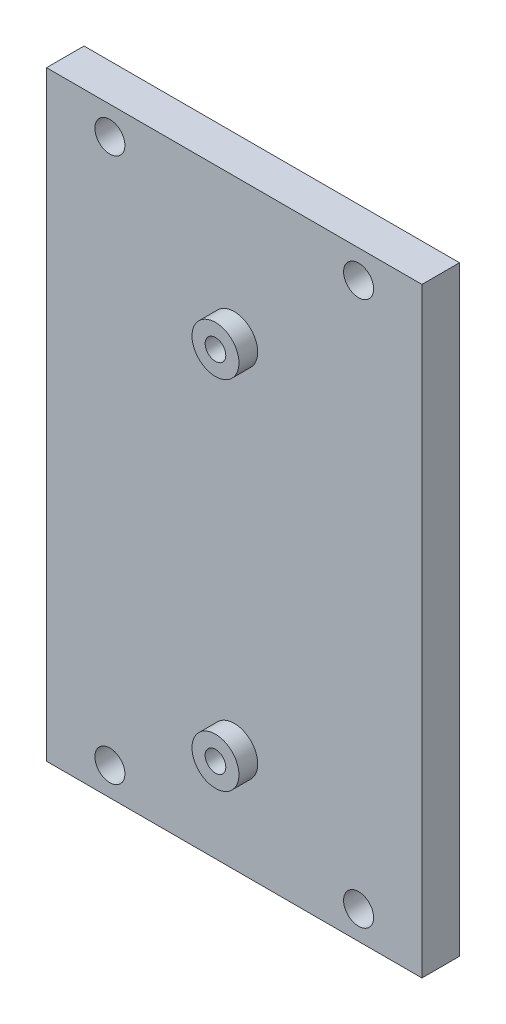
from build123d import *

# Parameters (mm, degrees)
SKETCH_1_W      = 40
SKETCH_1_H      = 64
SKETCH_1_R      = 1.6
SKETCH_1_R_2    = 1.1
EXTRUDE_1_DEPTH = 4
SKETCH_2_R      = 2.5
SKETCH_2_R_2    = 1.1
EXTRUDE_2_DEPTH = 2


with BuildPart() as part:
    # Эскиз1 → Бобышка-Вытянуть1 (new body)
    with BuildSketch(Plane.XY):
        Rectangle(SKETCH_1_W, SKETCH_1_H)
        with Locations((-13.25, 29)):
            Circle(SKETCH_1_R, mode=Mode.SUBTRACT)
        with Locations((13.25, 29)):
            Circle(SKETCH_1_R, mode=Mode.SUBTRACT)
        with Locations((-13.25, -29)):
            Circle(SKETCH_1_R, mode=Mode.SUBTRACT)
        with Locations((13.25, -29)):
            Circle(SKETCH_1_R, mode=Mode.SUBTRACT)
        with Locations((0, -21)):
            Circle(SKETCH_1_R_2, mode=Mode.SUBTRACT)
        with Locations((0, 17)):
            Circle(SKETCH_1_R_2, mode=Mode.SUBTRACT)
    extrude(amount=EXTRUDE_1_DEPTH)

    # Эскиз2 → Бобышка-Вытянуть2 (add)
    # profile 1 of 2: a face of its own
    with BuildSketch(Plane.XY.offset(4)):
        with Locations(Location((0, 17, 0), (0, 0, 180))):
            Circle(SKETCH_2_R)
        with Locations((0, 17)):
            Circle(SKETCH_2_R_2, mode=Mode.SUBTRACT)
    # profile 2 of 2: a face of its own
    with BuildSketch(Plane.XY.offset(4)):
        with Locations(Location((0, -21, 0), (0, 0, 180))):
            Circle(SKETCH_2_R)
        with Locations((0, -21)):
            Circle(SKETCH_2_R_2, mode=Mode.SUBTRACT)
    extrude(amount=EXTRUDE_2_DEPTH)


solid = part.part
